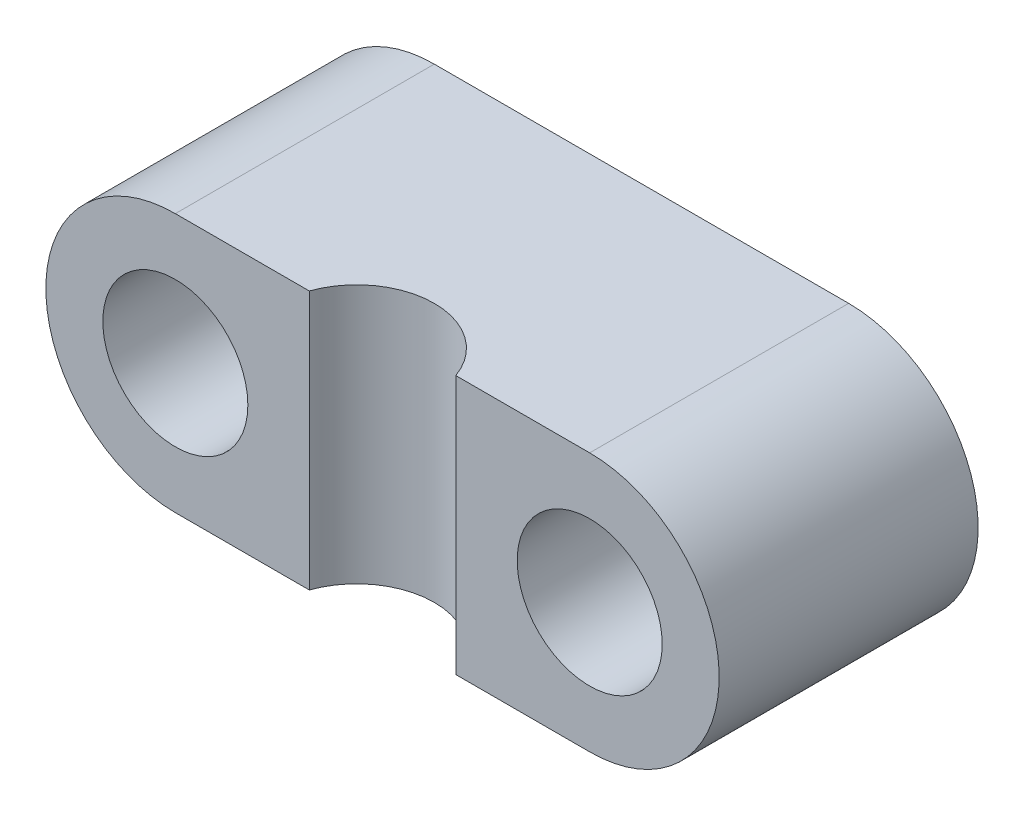
from build123d import *

# Parameters (mm, degrees)
SKETCH1_R           = 1.4
BOSS_EXTRUDE1_DEPTH = 5
SKETCH2_R           = 1.5
CUT_EXTRUDE1_DEPTH  = 10.604686356


with BuildPart() as part:
    # Sketch1 → Boss-Extrude1 (new body)
    with BuildSketch(Plane.XY):
        with BuildLine():
            Line((-4, -2.5), (4, -2.5))
            ThreePointArc((4, -2.5), (6.5, 0), (4, 2.5))
            Line((4, 2.5), (-4, 2.5))
            ThreePointArc((-4, 2.5), (-6.5, 0), (-4, -2.5))
        make_face()
        with Locations((-4, 0)):
            Circle(SKETCH1_R, mode=Mode.SUBTRACT)
        with Locations((4, 0)):
            Circle(SKETCH1_R, mode=Mode.SUBTRACT)
    extrude(amount=BOSS_EXTRUDE1_DEPTH)

    # Sketch2 → Cut-Extrude1 (cut, through all)
    with BuildSketch(Plane(origin=(0, 2.5, 0), x_dir=(1, 0, 0), z_dir=(0, 1, 0))):
        with Locations((0, -5.5)):
            Circle(SKETCH2_R)
    extrude(amount=-CUT_EXTRUDE1_DEPTH, mode=Mode.SUBTRACT)


solid = part.part
